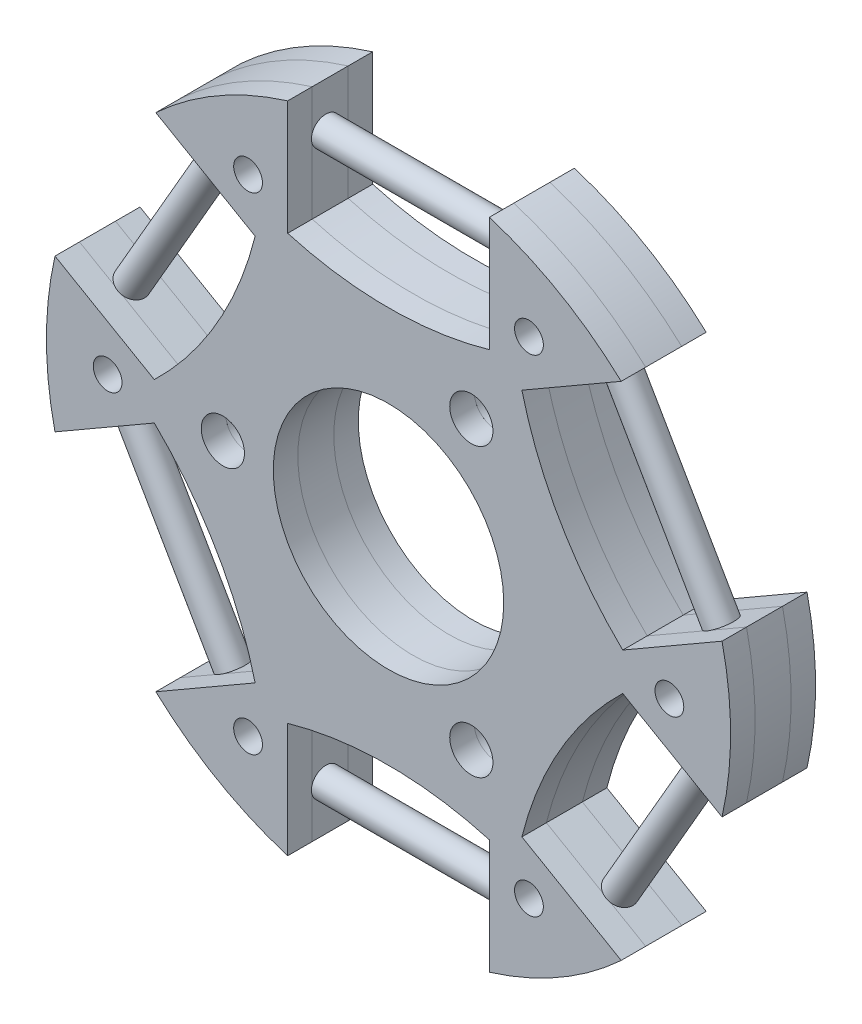
from build123d import *

# Parameters (mm, degrees)
SKETCH_1_R               = 25.4
SKETCH_1_R_2             = 8
EXTRUDE_1_DEPTH          = 1.7
SKETCH_2_R               = 25.4
SKETCH_2_R_2             = 3.5
EXTRUDE_2_DEPTH          = 2.5
SKETCH_3_R               = 25.4
SKETCH_3_R_2             = 8
EXTRUDE_3_DEPTH          = 1.7
CUT_EXTRUDE_START        = -20.5
CUT_EXTRUDE_1_DEPTH      = 20.5
SKETCH_5_R               = 1
CUT_EXTRUDE_2_DEPTH      = 20.5
SKETCH_6_R               = 1
EXTRUDE_4_DEPTH          = 14
PATTERN_CIRCULAR_1_COUNT = 6
SKETCH_7_R               = 1
CUT_EXTRUDE_3_DEPTH      = 14
CUT_EXTRUDE_START_2      = -10
SKETCH_8_R               = 25.4
SKETCH_8_R_2             = 23.75
CUT_EXTRUDE_4_DEPTH      = 10
SKETCH_9_R               = 8
CUT_EXTRUDE_5_DEPTH      = 34.375664787
SKETCH_10_R              = 1.5
CUT_EXTRUDE_6_DEPTH      = 34.375664787


with BuildPart() as part:
    # 草图1 → 凸台-拉伸1 (new body)
    with BuildSketch(Plane.XY):
        Circle(SKETCH_1_R)
        Circle(SKETCH_1_R_2, mode=Mode.SUBTRACT)
    extrude(amount=EXTRUDE_1_DEPTH)


with BuildPart() as body_2:
    # 草图2 → 凸台-拉伸2 (new body)
    with BuildSketch(Plane.XY.offset(1.7)):
        Circle(SKETCH_2_R)
        Circle(SKETCH_2_R_2, mode=Mode.SUBTRACT)
    extrude(amount=EXTRUDE_2_DEPTH)


with BuildPart() as body_3:
    # 草图3 → 凸台-拉伸3 (new body)
    with BuildSketch(Plane.XY.offset(4.2)):
        Circle(SKETCH_3_R)
        Circle(SKETCH_3_R_2, mode=Mode.SUBTRACT)
    extrude(amount=EXTRUDE_3_DEPTH)


with BuildPart() as cut_extrude_1_tool:
    # 草图4 → 切除-拉伸1 (new body)
    with BuildSketch(Plane.XY.offset(5.9).offset(CUT_EXTRUDE_START)):
        with BuildLine():
            Line((9.259682334, 13.428983857), (17.645212224, 18.270371796))
            ThreePointArc((17.645212224, 18.270371796), (21.997045256, 12.7), (24.645212224, 6.146016143))
            Line((24.645212224, 6.146016143), (16.259682334, 1.304628204))
            ThreePointArc((16.259682334, 1.304628204), (11.907849302, 6.875), (9.259682334, 13.428983857))
        make_face()
        with BuildLine():
            Line((7, 14.733612061), (7, 24.416387939))
            ThreePointArc((7, 24.416387939), (0, 25.4), (-7, 24.416387939))
            Line((-7, 24.416387939), (-7, 14.733612061))
            ThreePointArc((-7, 14.733612061), (0, 13.75), (7, 14.733612061))
        make_face()
        with BuildLine():
            Line((16.259682334, -1.304628204), (24.645212224, -6.146016143))
            ThreePointArc((24.645212224, -6.146016143), (21.997045256, -12.7), (17.645212224, -18.270371796))
            Line((17.645212224, -18.270371796), (9.259682334, -13.428983857))
            ThreePointArc((9.259682334, -13.428983857), (11.907849302, -6.875), (16.259682334, -1.304628204))
        make_face()
        with BuildLine():
            Line((7, -14.733612061), (7, -24.416387939))
            ThreePointArc((7, -24.416387939), (0, -25.4), (-7, -24.416387939))
            Line((-7, -24.416387939), (-7, -14.733612061))
            ThreePointArc((-7, -14.733612061), (0, -13.75), (7, -14.733612061))
        make_face()
        with BuildLine():
            Line((-9.259682334, -13.428983857), (-17.645212224, -18.270371796))
            ThreePointArc((-17.645212224, -18.270371796), (-21.997045256, -12.7), (-24.645212224, -6.146016143))
            Line((-24.645212224, -6.146016143), (-16.259682334, -1.304628204))
            ThreePointArc((-16.259682334, -1.304628204), (-11.907849302, -6.875), (-9.259682334, -13.428983857))
        make_face()
        with BuildLine():
            Line((-16.259682334, 1.304628204), (-24.645212224, 6.146016143))
            ThreePointArc((-24.645212224, 6.146016143), (-21.997045256, 12.7), (-17.645212224, 18.270371796))
            Line((-17.645212224, 18.270371796), (-9.259682334, 13.428983857))
            ThreePointArc((-9.259682334, 13.428983857), (-11.907849302, 6.875), (-16.259682334, 1.304628204))
        make_face()
    extrude(amount=CUT_EXTRUDE_1_DEPTH)


with BuildPart() as part_1:
    add(part.part)

    # 切除-拉伸1: cut by cut_extrude_1_tool
    add(cut_extrude_1_tool.part, mode=Mode.SUBTRACT)


with BuildPart() as body_2_1:
    add(body_2.part)

    # 切除-拉伸1: cut by cut_extrude_1_tool
    add(cut_extrude_1_tool.part, mode=Mode.SUBTRACT)


with BuildPart() as body_3_1:
    add(body_3.part)

    # 切除-拉伸1: cut by cut_extrude_1_tool
    add(cut_extrude_1_tool.part, mode=Mode.SUBTRACT)


with BuildPart() as cut_extrude_2_tool:
    # 草图5 → 切除-拉伸2 (new body)
    with BuildSketch(Plane.XY.offset(5.9)):
        with Locations((9.75, 16.887495374)):
            Circle(SKETCH_5_R)
        with Locations((19.5, 0)):
            Circle(SKETCH_5_R)
        with Locations((9.75, -16.887495374)):
            Circle(SKETCH_5_R)
        with Locations((-9.75, -16.887495374)):
            Circle(SKETCH_5_R)
        with Locations((-19.5, 0)):
            Circle(SKETCH_5_R)
        with Locations((-9.75, 16.887495374)):
            Circle(SKETCH_5_R)
    extrude(amount=-CUT_EXTRUDE_2_DEPTH)


with BuildPart() as part_2:
    add(part_1.part)

    # 切除-拉伸2: cut by cut_extrude_2_tool
    add(cut_extrude_2_tool.part, mode=Mode.SUBTRACT)


with BuildPart() as body_2_2:
    add(body_2_1.part)

    # 切除-拉伸2: cut by cut_extrude_2_tool
    add(cut_extrude_2_tool.part, mode=Mode.SUBTRACT)

    # 草图6 → 凸台-拉伸4 (add)
    with BuildSketch(Plane(origin=(-7, 0, 0), x_dir=(0, 0, -1), z_dir=(1, 0, 0))):
        with Locations(Location((-3.25, 19.575, 0), (0, 0, 198.194872339))):
            Circle(SKETCH_6_R)
    extrude_4 = extrude(amount=EXTRUDE_4_DEPTH)

    # 阵列(圆周)1: 凸台-拉伸4 ×6 about axis
    pattern_circular_1_axis = Axis((0, 0, 0), (0, 0, 1))
    for i in range(1, PATTERN_CIRCULAR_1_COUNT):
        add(extrude_4.rotate(pattern_circular_1_axis, i * 360 / PATTERN_CIRCULAR_1_COUNT))

    # 草图7 → 切除-拉伸3 (cut)
    with BuildSketch(Plane.XY.offset(4.2)):
        with Locations((-7, 0)):
            Circle(SKETCH_7_R)
        with Locations((0, 7)):
            Circle(SKETCH_7_R)
        with Locations((7, 0)):
            Circle(SKETCH_7_R)
        with Locations((0, -7)):
            Circle(SKETCH_7_R)
    extrude(amount=-CUT_EXTRUDE_3_DEPTH, mode=Mode.SUBTRACT)


with BuildPart() as body_3_2:
    add(body_3_1.part)

    # 切除-拉伸2: cut by cut_extrude_2_tool
    add(cut_extrude_2_tool.part, mode=Mode.SUBTRACT)


with BuildPart() as cut_extrude_4_tool:
    # 草图8 → 切除-拉伸4 (new body)
    with BuildSketch(Plane.XY.offset(5.9).offset(CUT_EXTRUDE_START_2)):
        Circle(SKETCH_8_R)
        Circle(SKETCH_8_R_2, mode=Mode.SUBTRACT)
    extrude(amount=CUT_EXTRUDE_4_DEPTH)


with BuildPart() as part_3:
    add(part_2.part)

    # 切除-拉伸4: cut by cut_extrude_4_tool
    add(cut_extrude_4_tool.part, mode=Mode.SUBTRACT)


with BuildPart() as body_2_3:
    add(body_2_2.part)

    # 切除-拉伸4: cut by cut_extrude_4_tool
    add(cut_extrude_4_tool.part, mode=Mode.SUBTRACT)

    # 草图9 → 切除-拉伸5 (cut, through all)
    with BuildSketch(Plane.XY.offset(5.9)):
        Circle(SKETCH_9_R)
    extrude(amount=-CUT_EXTRUDE_5_DEPTH, mode=Mode.SUBTRACT)


with BuildPart() as body_3_3:
    add(body_3_2.part)

    # 切除-拉伸4: cut by cut_extrude_4_tool
    add(cut_extrude_4_tool.part, mode=Mode.SUBTRACT)


with BuildPart() as cut_extrude_6_tool:
    # 草图10 → 切除-拉伸6 (new, through all)
    with BuildSketch(Plane(origin=(0, 0, 0), x_dir=(-1, 0, 0), z_dir=(0, 0, -1))):
        with Locations((-5.75, 9.959292144)):
            Circle(SKETCH_10_R)
        with Locations((11.5, 0)):
            Circle(SKETCH_10_R)
        with Locations((-5.75, -9.959292144)):
            Circle(SKETCH_10_R)
    extrude(amount=-CUT_EXTRUDE_6_DEPTH)


with BuildPart() as part_4:
    add(part_3.part)

    # 切除-拉伸6: cut by cut_extrude_6_tool
    add(cut_extrude_6_tool.part, mode=Mode.SUBTRACT)


with BuildPart() as body_2_4:
    add(body_2_3.part)

    # 切除-拉伸6: cut by cut_extrude_6_tool
    add(cut_extrude_6_tool.part, mode=Mode.SUBTRACT)


with BuildPart() as body_3_4:
    add(body_3_3.part)

    # 切除-拉伸6: cut by cut_extrude_6_tool
    add(cut_extrude_6_tool.part, mode=Mode.SUBTRACT)


solid = Compound([part_4.part, body_2_4.part, body_3_4.part])
